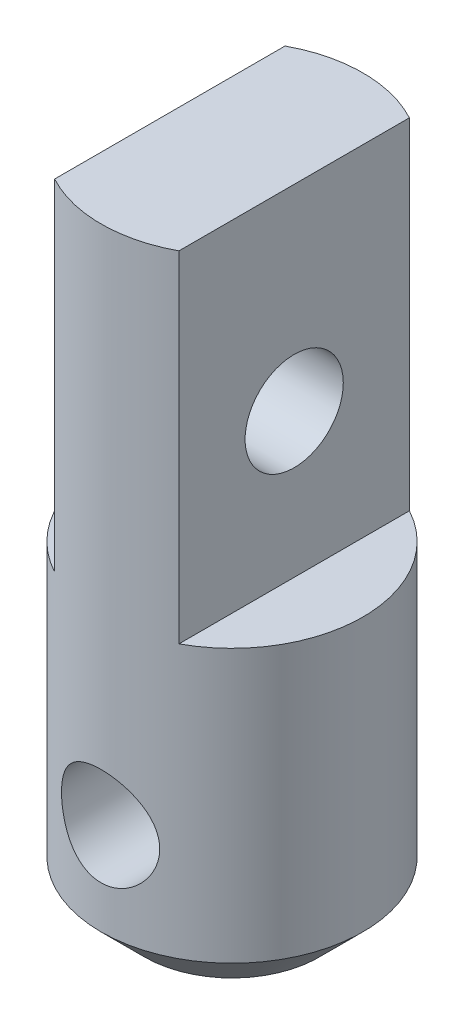
from build123d import *
from build123d.topology import SkipClean

# Parameters (mm, degrees)
SKETCH2_R            = 6
BOSS_EXTRUDE1_DEPTH  = 14.5
CHAMFER1_SIZE        = 2
BOSS_EXTRUDE3_DEPTH  = 15.6
M4_CLEARANCE_HOLE1_D = 4.5
M4_CLEARANCE_HOLE2_D = 4.5


with BuildPart() as part:
    # Sketch2 → Boss-Extrude1 (new body)
    with BuildSketch(Plane(origin=(0, 0, 0), x_dir=(1, 0, 0), z_dir=(0, 1, 0))):
        with Locations(Location((0, 0, 0), (0, 0, 90))):
            Circle(SKETCH2_R)
    extrude(amount=BOSS_EXTRUDE1_DEPTH)

    # Chamfer1
    chamfer1_edges = [part.edges().sort_by_distance(p)[0] for p in [
        (0, 0, 6),
    ]]
    chamfer(chamfer1_edges, length=CHAMFER1_SIZE)

    # Sketch3 → Boss-Extrude3 (add)
    with SkipClean():  # the faces are left unmerged after this step: merging them gives an invalid solid
        with BuildSketch(Plane(origin=(0, 14.5, 0), x_dir=(1, 0, 0), z_dir=(0, 1, 0))):
            with BuildLine():
                Line((-2.85, 0), (-2.85, 5.279915))
                ThreePointArc((-2.85, 5.279915), (0, 6), (2.85, 5.279915))
                Line((2.85, 5.279915), (2.85, -5.279915))
                ThreePointArc((2.85, -5.279915), (0, -6), (-2.85, -5.279915))
                Line((-2.85, -5.279915), (-2.85, 0))
            make_face()
        extrude(amount=BOSS_EXTRUDE3_DEPTH)

    # M4 Clearance Hole1 (through all)
    with Locations(Plane.XY.offset(6)):
        with Locations((0, 6.2)):
            Hole(M4_CLEARANCE_HOLE1_D / 2)

    # M4 Clearance Hole2 (through all)
    with Locations(Plane(origin=(2.85, 0, 0), x_dir=(0, 0, -1), z_dir=(1, 0, 0))):
        with Locations((0, 21.1)):
            Hole(M4_CLEARANCE_HOLE2_D / 2)


solid = part.part
